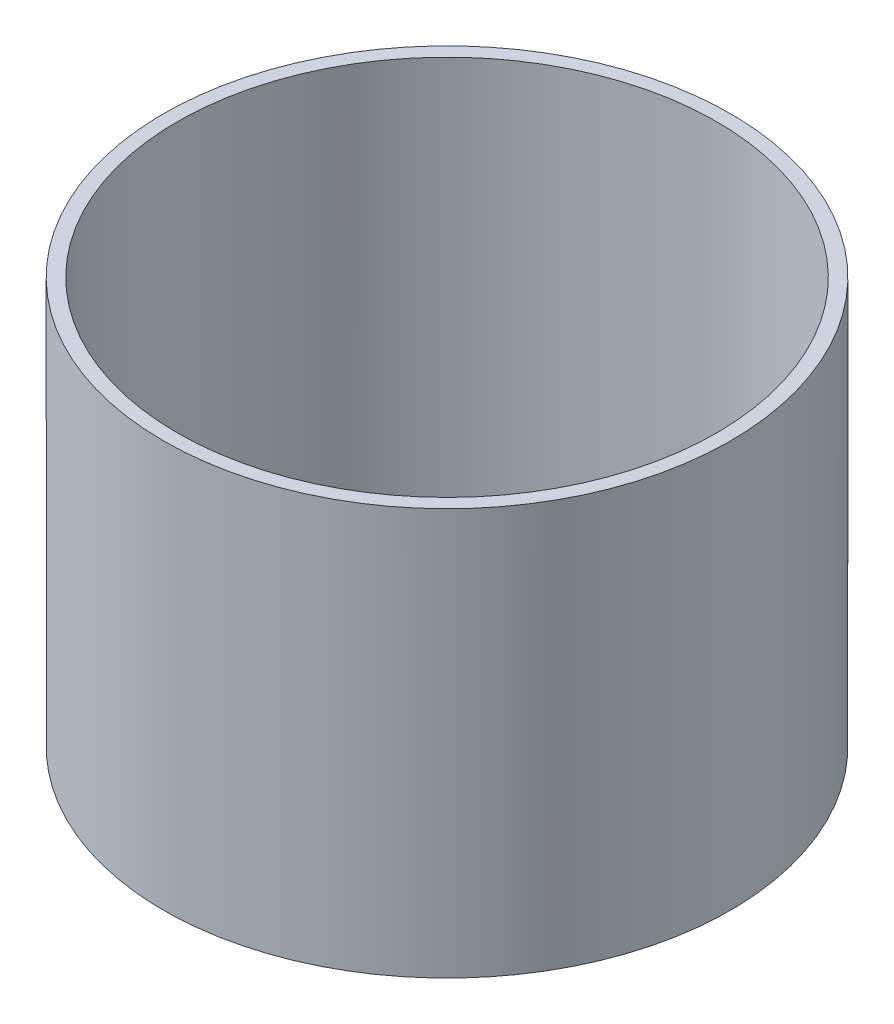
from build123d import *

# Parameters (mm, degrees)
SKETCH1_R           = 41
SKETCH1_R_2         = 39
BOSS_EXTRUDE1_DEPTH = 58.8
SKETCH2_R           = 10.45
CUT_EXTRUDE1_DEPTH  = 83.579900702


with BuildPart() as part:
    # Sketch1 → Boss-Extrude1 (new body)
    with BuildSketch(Plane(origin=(0, 0, 0), x_dir=(1, 0, 0), z_dir=(0, 1, 0))):
        with Locations(Location((0, 0, 0), (0, 0, 270))):
            Circle(SKETCH1_R)
        with Locations(Location((0, 0, 0), (0, 0, 270))):
            Circle(SKETCH1_R_2, mode=Mode.SUBTRACT)
    extrude(amount=BOSS_EXTRUDE1_DEPTH)

    # Sketch2 → Cut-Extrude1 (cut, through all)
    with BuildSketch(Plane.XY):
        Circle(SKETCH2_R)
    extrude(amount=-CUT_EXTRUDE1_DEPTH, mode=Mode.SUBTRACT)


solid = part.part
